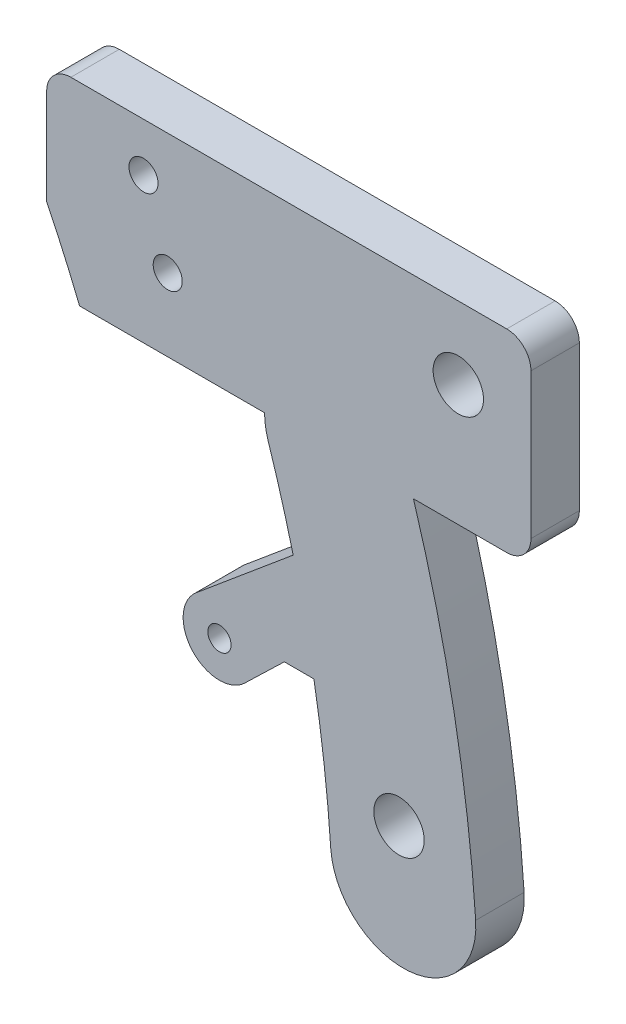
from build123d import *

# Parameters (mm, degrees)
SKETCH1_R           = 3.302
BOSS_EXTRUDE1_DEPTH = 6.35
FILLET1_R           = 3.175
SKETCH2_R           = 1.905
CUT_EXTRUDE2_DEPTH  = 6.35
BOSS_EXTRUDE2_START = -6.35
SKETCH3_R           = 1.524
BOSS_EXTRUDE2_DEPTH = 6.35


with BuildPart() as part:
    # Sketch1 → Boss-Extrude1 (new body)
    # profile 1 of 8: a face of its own
    with BuildSketch(Plane.XY):
        with BuildLine():
            Line((141.278581179, 57.15), (154.893148654, 57.15))
            ThreePointArc((154.893148654, 57.15), (149.477461353, 70.103484559), (142.980794165, 82.55))
            Line((142.980794165, 82.55), (136.957419152, 82.55))
            Line((136.957419152, 82.55), (136.957419152, 66.846281418))
            ThreePointArc((136.957419152, 66.846281418), (139.202451266, 62.035776465), (141.278581179, 57.15))
        make_face()
    # profile 2 of 8: a face of its own
    with BuildSketch(Plane.XY):
        with BuildLine():
            Line((154.893148654, 57.15), (165.008388044, 57.15))
            ThreePointArc((165.008388044, 57.15), (159.949723048, 70.071226062), (153.881084364, 82.55))
            Line((153.881084364, 82.55), (142.980794165, 82.55))
            ThreePointArc((142.980794165, 82.55), (149.477461353, 70.103484559), (154.893148654, 57.15))
        make_face()
    # profile 3 of 8: a face of its own
    with BuildSketch(Plane.XY):
        with BuildLine():
            Line((165.008388044, 57.15), (165.532419152, 57.15))
            ThreePointArc((165.532419152, 57.15), (173.560812364, 66.556688744), (184.112113246, 60.106034483))
            ThreePointArc((184.112113246, 60.106034483), (180.006858286, 71.467031526), (175.201321699, 82.55))
            Line((175.201321699, 82.55), (153.881084364, 82.55))
            ThreePointArc((153.881084364, 82.55), (159.949723048, 70.071226062), (165.008388044, 57.15))
        make_face()
    # profile 4 of 8: a face of its own
    with BuildSketch(Plane.XY):
        with BuildLine():
            ThreePointArc((184.112113246, 60.106034483), (184.587488278, 58.629896777), (185.051028435, 57.15))
            Line((185.051028435, 57.15), (194.997737166, 57.15))
            Line((194.997737166, 57.15), (200.457419152, 57.15))
            Line((200.457419152, 57.15), (200.457419152, 82.55))
            Line((200.457419152, 82.55), (175.201321699, 82.55))
            ThreePointArc((175.201321699, 82.55), (180.006858286, 71.467031526), (184.112113246, 60.106034483))
        make_face()
        with Locations((190.932419152, 73.025)):
            Circle(SKETCH1_R, mode=Mode.SUBTRACT)
    # profile 5 of 8: a face of its own
    with BuildSketch(Plane.XY):
        with BuildLine():
            Line((165.532419152, 57.15), (175.057419152, 57.15))
            Line((175.057419152, 57.15), (185.051028435, 57.15))
            ThreePointArc((185.051028435, 57.15), (184.587488278, 58.629896777), (184.112113246, 60.106034483))
            ThreePointArc((184.112113246, 60.106034483), (173.560812364, 66.556688744), (165.532419152, 57.15))
        make_face()
    # profile 6 of 8: a face of its own
    with BuildSketch(Plane.XY):
        with BuildLine():
            Line((185.051028435, 57.15), (175.057419152, 57.15))
            ThreePointArc((175.057419152, 57.15), (179.769184167, 39.92822215), (182.790987009, 22.331089728))
            ThreePointArc((182.790987009, 22.331089728), (185.361789246, 21.512549972), (186.464004794, 19.05))
            ThreePointArc((186.464004794, 19.05), (185.604733587, 16.828225925), (183.474131965, 15.762785278))
            ThreePointArc((183.474131965, 15.762785278), (183.905882161, 9.478871593), (184.122474139, 3.183868229))
            ThreePointArc((184.122474139, 3.183868229), (190.813712192, 6.352963326), (193.213868393, 13.356896552))
            ThreePointArc((193.213868393, 13.356896552), (190.395751057, 35.488922277), (185.051028435, 57.15))
        make_face()
    # profile 7 of 8: a face of its own
    with BuildSketch(Plane.XY):
        with BuildLine():
            ThreePointArc((182.790987009, 22.331089728), (179.769184167, 39.92822215), (175.057419152, 57.15))
            Line((175.057419152, 57.15), (165.538614463, 56.806514484))
            ThreePointArc((165.538614463, 56.806514484), (165.679249432, 55.483999485), (166.002725058, 54.193965517))
            ThreePointArc((166.002725058, 54.193965517), (171.406582826, 33.37175436), (174.209225601, 12.043103448))
            ThreePointArc((174.209225601, 12.043103448), (177.364510323, 5.597834805), (184.122474139, 3.183868229))
            ThreePointArc((184.122474139, 3.183868229), (183.905882161, 9.478871593), (183.474131965, 15.762785278))
            ThreePointArc((183.474131965, 15.762785278), (179.87772057, 18.708413793), (182.790987009, 22.331089728))
        make_face()
    # profile 8 of 8: a face of its own
    with BuildSketch(Plane.XY):
        with BuildLine():
            Line((165.538614463, 56.806514484), (175.057419152, 57.15))
            Line((175.057419152, 57.15), (165.532419152, 57.15))
            ThreePointArc((165.532419152, 57.15), (165.533968105, 56.978229309), (165.538614463, 56.806514484))
        make_face()
    extrude(amount=BOSS_EXTRUDE1_DEPTH)

    # Fillet1
    fillet1_edges = [part.edges().sort_by_distance(p)[0] for p in [
        (136.957419152, 82.55, 3.175),
        (200.457419152, 82.55, 3.175),
        (200.457419152, 57.15, 3.175),
    ]]
    fillet(fillet1_edges, radius=FILLET1_R)

    # Sketch2 → Cut-Extrude2 (cut)
    with BuildSketch(Plane.XY.offset(6.35)):
        with Locations((149.657419152, 76.2)):
            Circle(SKETCH2_R)
        with Locations((152.832419152, 66.675)):
            Circle(SKETCH2_R)
    extrude(amount=-CUT_EXTRUDE2_DEPTH, mode=Mode.SUBTRACT)

    # Sketch3 → Boss-Extrude2 (add)
    with BuildSketch(Plane.XY.offset(6.35).offset(BOSS_EXTRUDE2_START)):
        with BuildLine():
            ThreePointArc((172.000332031, 30.1625), (170.759719622, 36.537771957), (169.282889622, 42.8625))
            Line((169.282889622, 42.8625), (156.561270912, 32.229125785))
            ThreePointArc((156.561270912, 32.229125785), (156.072362343, 25.392696876), (162.921852432, 25.147182454))
            Line((162.921852432, 25.147182454), (168.121534475, 30.1625))
            Line((168.121534475, 30.1625), (172.000332031, 30.1625))
        make_face()
        with Locations((159.615574597, 28.575)):
            Circle(SKETCH3_R, mode=Mode.SUBTRACT)
    extrude(amount=BOSS_EXTRUDE2_DEPTH)


solid = part.part
